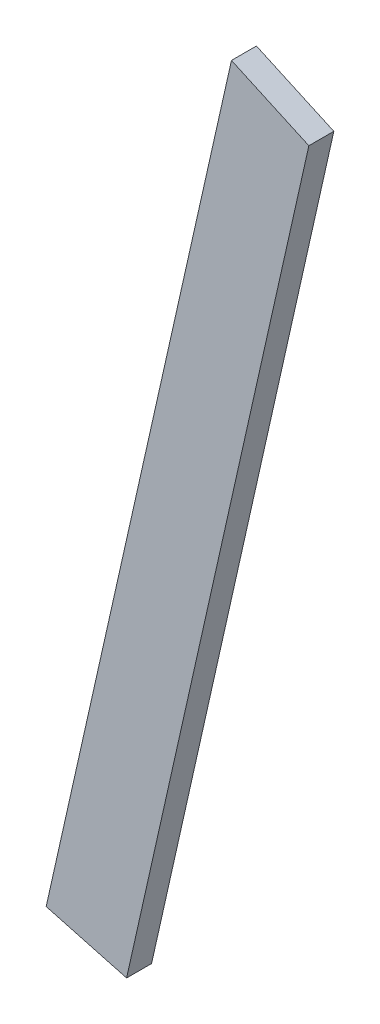
from build123d import *

# Parameters (mm, degrees)
BOSS_EXTRUDE1_DEPTH = 19.05


with BuildPart() as part:
    # Sketch6 → Boss-Extrude1 (new body)
    with BuildSketch(Plane.XY):
        Polygon((-596.865528173, 1608.234044775), (-738.251729964, 978.422782255), (-676.886193392, 961.874772393), (-537.811094831, 1581.391120529), align=None)
    extrude(amount=BOSS_EXTRUDE1_DEPTH)


solid = part.part
